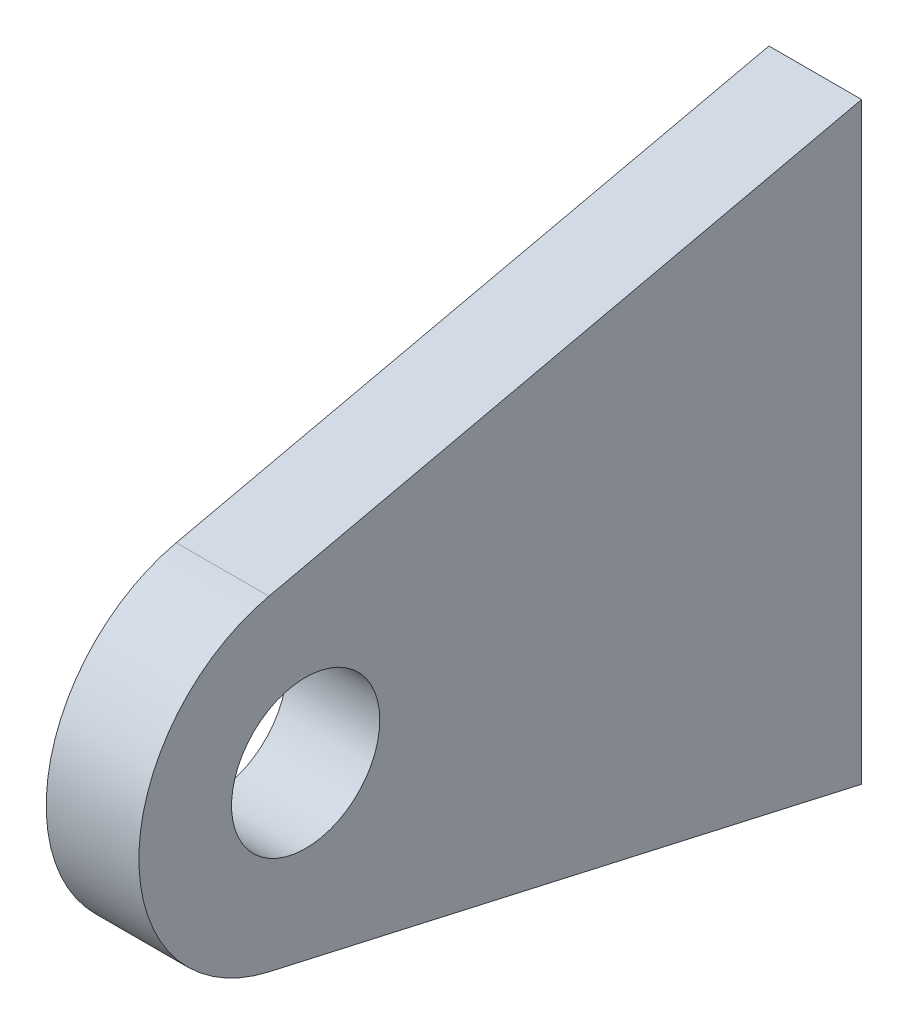
from build123d import *

# Parameters (mm, degrees)
SKETCH1_R           = 4
BOSS_EXTRUDE1_DEPTH = 2.5


with BuildPart() as part:
    # Sketch1 → Boss-Extrude1 (new, symmetric)
    with BuildSketch(Plane.YZ):
        with BuildLine():
            Line((-16, 0), (16, 0))
            Line((16, 0), (8.779015578, 31.982141641))
            ThreePointArc((8.779015578, 31.982141641), (0, 39), (-8.779015578, 31.982141641))
            Line((-8.779015578, 31.982141641), (-16, 0))
        make_face()
        with Locations(Location((0, 30, 0), (0, 0, 270))):
            Circle(SKETCH1_R, mode=Mode.SUBTRACT)
    extrude(amount=BOSS_EXTRUDE1_DEPTH, both=True)


solid = part.part
